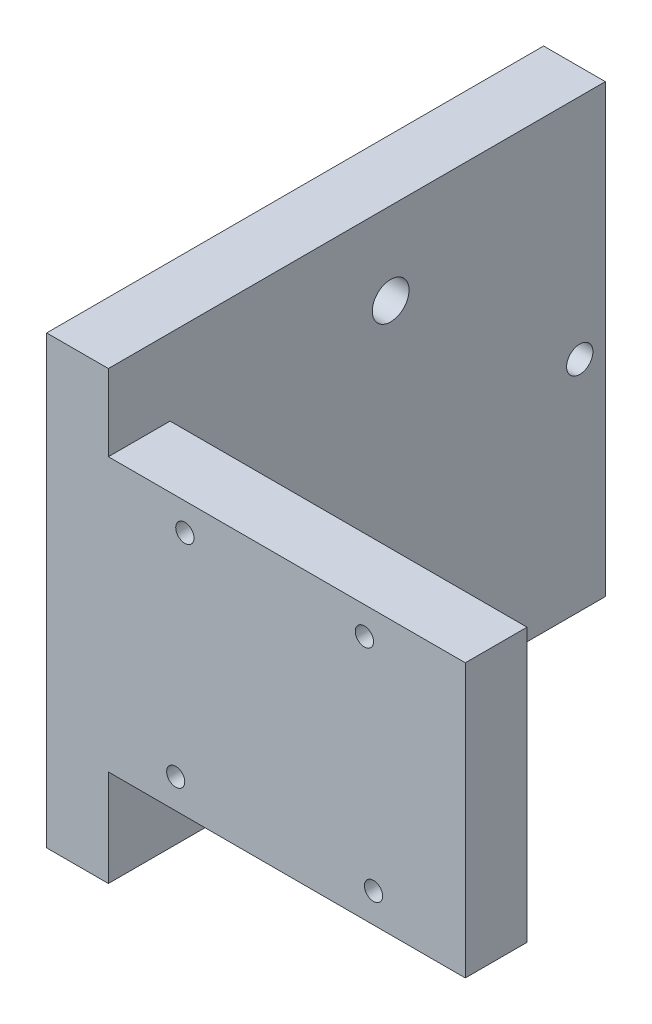
from build123d import *

# Parameters (mm, degrees)
EXTRUDE_THIN1_DEPTH = 22
SKETCH4_R           = 0.649105381
SKETCH4_R_2         = 0.65234644
SKETCH4_R_3         = 0.906952967
SKETCH4_W           = 5.036303432
SKETCH4_H           = 5.470796117
CUT_EXTRUDE2_DEPTH  = 38.347454818
SKETCH8_R           = 0.450837693
SKETCH8_R_2         = 0.449707116
SKETCH8_R_3         = 0.445855953
CUT_EXTRUDE5_DEPTH  = 38.347454818
SKETCH9_W           = 17.606045563
SKETCH9_H           = 3.76709992
SKETCH9_H_2         = 4.767878547
CUT_EXTRUDE6_DEPTH  = 38.347454818


with BuildPart() as part:
    # Sketch2 → Extrude-Thin1 (new body)
    with BuildSketch(Plane(origin=(0, 0, 0), x_dir=(1, 0, 0), z_dir=(0, 1, 0))):
        Polygon((0, 0), (0, -21.46884451), (17.606045563, -21.46884451), (17.606045563, -24.512436456), (-3.043591946, -24.512436456), (-3.043591946, 0), align=None)
    extrude(amount=EXTRUDE_THIN1_DEPTH)

    # Sketch4 → Cut-Extrude2 (cut, through all)
    with BuildSketch(Plane(origin=(0, 0, 0), x_dir=(0, 0, -1), z_dir=(1, 0, 0))):
        with Locations((-1.261501122, 10.771672365)):
            Circle(SKETCH4_R)
        with Locations((-20.011001783, 10.771672365)):
            Circle(SKETCH4_R_2)
        with Locations((-10.589323514, 17.938155066)):
            Circle(SKETCH4_R_3)
        with Locations((-10.589323514, 0.943208514)):
            Rectangle(SKETCH4_W, SKETCH4_H)
    extrude(amount=-CUT_EXTRUDE2_DEPTH, mode=Mode.SUBTRACT)

    # Sketch8 → Cut-Extrude5 (cut, through all)
    with BuildSketch(Plane.XY):
        with Locations(Location((3.77269277, 16.868201952, 0), (0, 0, 180))):
            Circle(SKETCH8_R)
        with Locations(Location((12.628067292, 16.868201952, 0), (0, 0, 180))):
            Circle(SKETCH8_R)
        with Locations(Location((13.078904985, 6.223556551, 0), (0, 0, 180))):
            Circle(SKETCH8_R_2)
        with Locations(Location((3.321855077, 6.223556551, 0), (0, 0, 180))):
            Circle(SKETCH8_R_3)
    extrude(amount=CUT_EXTRUDE5_DEPTH, mode=Mode.SUBTRACT)

    # Sketch9 → Cut-Extrude6 (cut, through all)
    with BuildSketch(Plane.XY):
        with Locations((8.803022782, 20.11645004)):
            Rectangle(SKETCH9_W, SKETCH9_H)
        with Locations((8.803022782, 2.383939274)):
            Rectangle(SKETCH9_W, SKETCH9_H_2)
    extrude(amount=CUT_EXTRUDE6_DEPTH, mode=Mode.SUBTRACT)


solid = part.part
